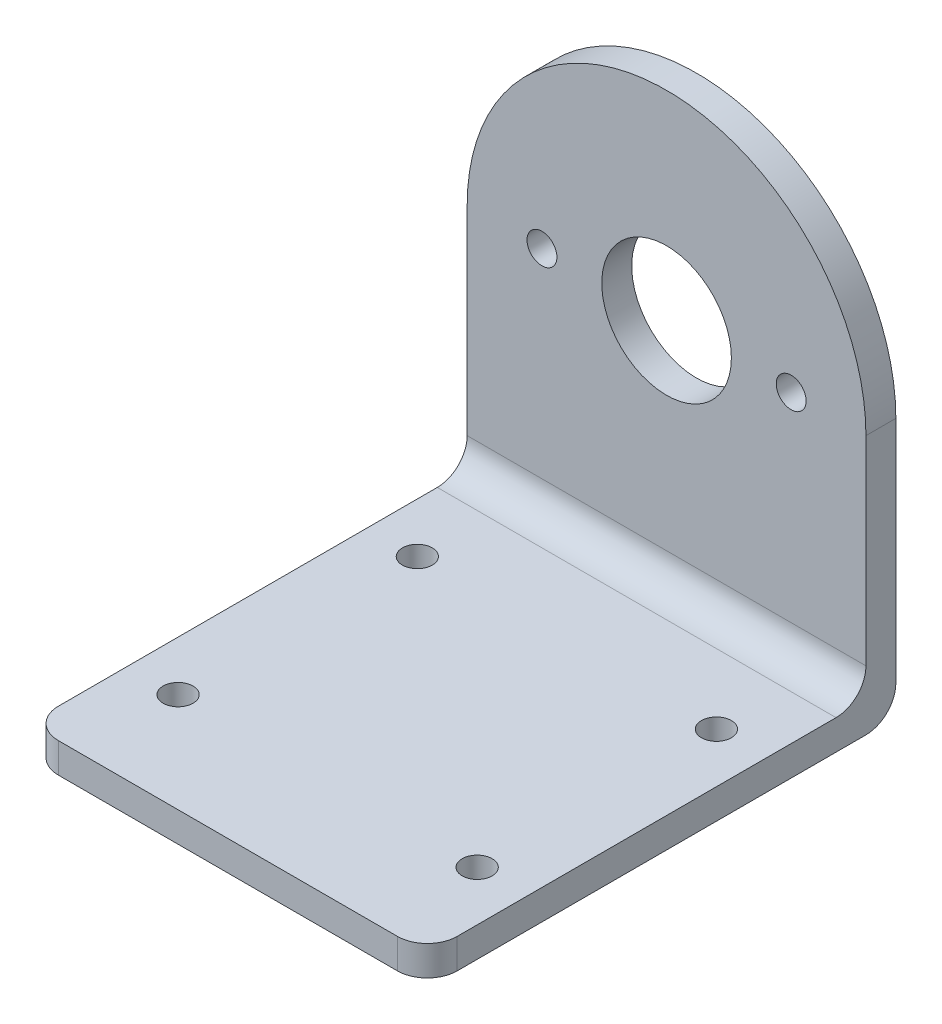
from build123d import *

# Parameters (mm, degrees)
SKETCH_1_R          = 6.5
SKETCH_1_R_2        = 1.5
EXTRUDE_1_DEPTH     = 3
SKETCH_2_W          = 40
SKETCH_2_H          = 3
EXTRUDE_2_DEPTH     = 44
FILLET_4_R          = 3
SKETCH_3_R          = 1.5
CUT_EXTRUDE_1_DEPTH = 77.974021592
FILLET_5_R          = 3
FILLET_6_R          = 3


with BuildPart() as part:
    # Эскиз1 → Бобышка-Вытянуть1 (new body)
    with BuildSketch(Plane.XY):
        with BuildLine():
            Line((0, 0), (40, 0))
            Line((40, 0), (40, 26))
            ThreePointArc((40, 26), (20, 46), (0, 26))
            Line((0, 26), (0, 0))
        make_face()
        with Locations((20, 26)):
            Circle(SKETCH_1_R, mode=Mode.SUBTRACT)
        with Locations((32.5, 26)):
            Circle(SKETCH_1_R_2, mode=Mode.SUBTRACT)
        with Locations((7.5, 26)):
            Circle(SKETCH_1_R_2, mode=Mode.SUBTRACT)
    extrude(amount=EXTRUDE_1_DEPTH)

    # Эскиз2 → Бобышка-Вытянуть2 (add)
    with BuildSketch(Plane.XY.offset(3)):
        with Locations((20, 1.5)):
            Rectangle(SKETCH_2_W, SKETCH_2_H)
    extrude(amount=EXTRUDE_2_DEPTH)

    # Скругление4
    fillet_4_edges = [part.edges().sort_by_distance(p)[0] for p in [
        (20, 0, 0),
    ]]
    fillet(fillet_4_edges, radius=FILLET_4_R)

    # Эскиз3 → Вырез-Вытянуть1 (cut, through all)
    with BuildSketch(Plane.XZ):
        with Locations(Location((5, 37, 0), (0, 0, 270))):
            Circle(SKETCH_3_R)
        with Locations(Location((35, 37, 0), (0, 0, 270))):
            Circle(SKETCH_3_R)
        with Locations(Location((5, 13, 0), (0, 0, 270))):
            Circle(SKETCH_3_R)
        with Locations(Location((35, 13, 0), (0, 0, 270))):
            Circle(SKETCH_3_R)
    extrude(amount=-CUT_EXTRUDE_1_DEPTH, mode=Mode.SUBTRACT)

    # Скругление5
    fillet_5_edges = [part.edges().sort_by_distance(p)[0] for p in [
        (20, 3, 3),
    ]]
    fillet(fillet_5_edges, radius=FILLET_5_R)

    # Скругление6
    fillet_6_edges = [part.edges().sort_by_distance(p)[0] for p in [
        (40, 1.5, 47),
        (0, 1.5, 47),
    ]]
    fillet(fillet_6_edges, radius=FILLET_6_R)


solid = part.part
